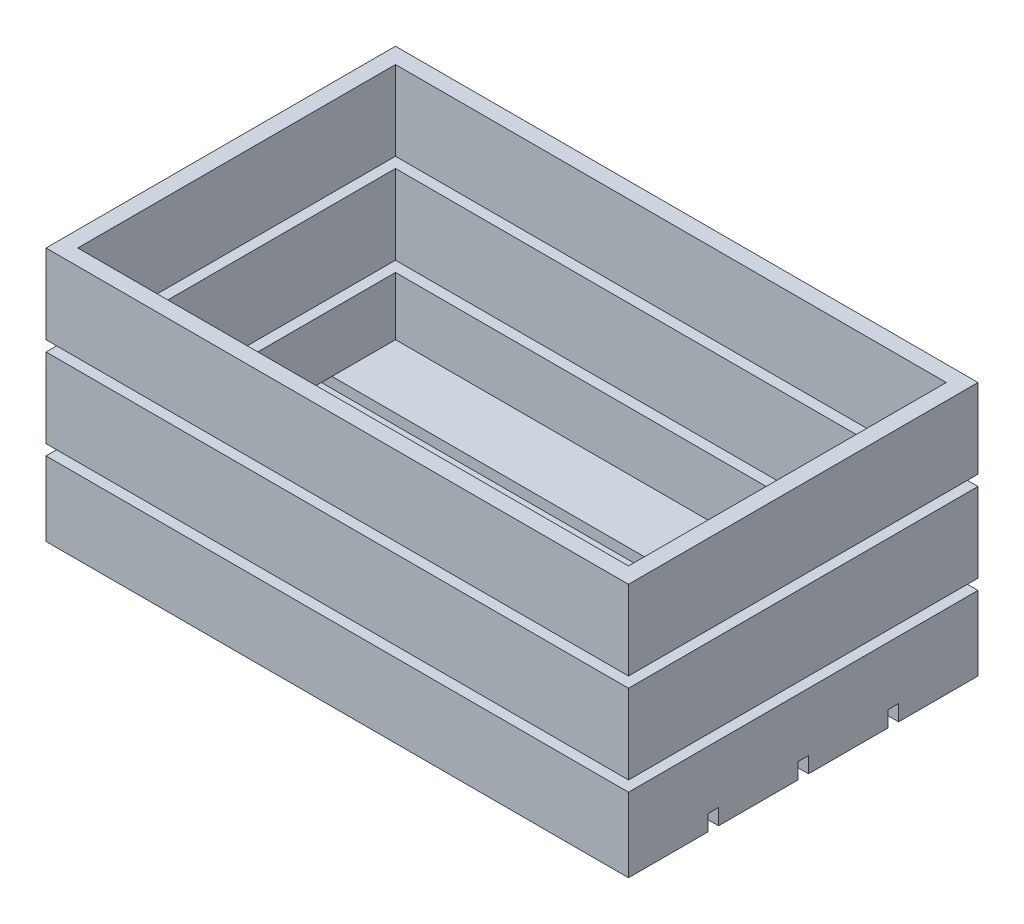
from build123d import *

# Parameters (mm, degrees)
SKETCH1_W           = 698.5
SKETCH1_H           = 419.1
BOSS_EXTRUDE1_DEPTH = 304.8
SHELL1_T            = -19.05
SKETCH2_W           = 698.5
SKETCH2_H           = 12.7
CUT_EXTRUDE1_DEPTH  = 625.918724715
SKETCH6_W           = 698.5
SKETCH6_H           = 12.7
CUT_EXTRUDE3_DEPTH  = 19.05


with BuildPart() as part:
    # Sketch1 → Boss-Extrude1 (new body)
    with BuildSketch(Plane(origin=(0, 0, 0), x_dir=(1, 0, 0), z_dir=(0, 1, 0))):
        Rectangle(SKETCH1_W, SKETCH1_H)
    extrude(amount=BOSS_EXTRUDE1_DEPTH)

    # Shell1
    shell1_openings = [part.faces().sort_by_distance(p)[0] for p in [
        (0, 304.8, 0),
    ]]
    offset(amount=SHELL1_T, openings=shell1_openings, kind=Kind.INTERSECTION)

    # Sketch2 → Cut-Extrude1 (cut, through all)
    with BuildSketch(Plane.XY.offset(209.55)):
        with Locations((0, 203.2)):
            Rectangle(SKETCH2_W, SKETCH2_H)
        with Locations((0, 95.25)):
            Rectangle(SKETCH2_W, SKETCH2_H)
    extrude(amount=-CUT_EXTRUDE1_DEPTH, mode=Mode.SUBTRACT)


with BuildPart() as cut_extrude1_piece_1:
    # of the separate pieces the step leaves, piece 1, a body of its own (cut_extrude1_pieces)
    add(part.part.solids().sort_by_distance((-349.25, 0, -209.55))[0])

    # Sketch6 → Cut-Extrude3 (cut)
    with BuildSketch(Plane.XZ):
        with Locations((0, 107.95)):
            Rectangle(SKETCH6_W, SKETCH6_H)
        Rectangle(SKETCH6_W, SKETCH6_H)
        with Locations((0, -107.95)):
            Rectangle(SKETCH6_W, SKETCH6_H)
    extrude(amount=-CUT_EXTRUDE3_DEPTH, mode=Mode.SUBTRACT)


with BuildPart() as cut_extrude1_piece_2:
    # of the separate pieces the step leaves, piece 2, a body of its own (cut_extrude1_pieces)
    add(part.part.solids().sort_by_distance((349.25, 209.55, -209.55))[0])


with BuildPart() as cut_extrude1_piece_3:
    # of the separate pieces the step leaves, piece 3, a body of its own (cut_extrude1_pieces)
    add(part.part.solids().sort_by_distance((349.25, 101.6, -209.55))[0])


solid = Compound([cut_extrude1_piece_1.part, cut_extrude1_piece_2.part, cut_extrude1_piece_3.part])
